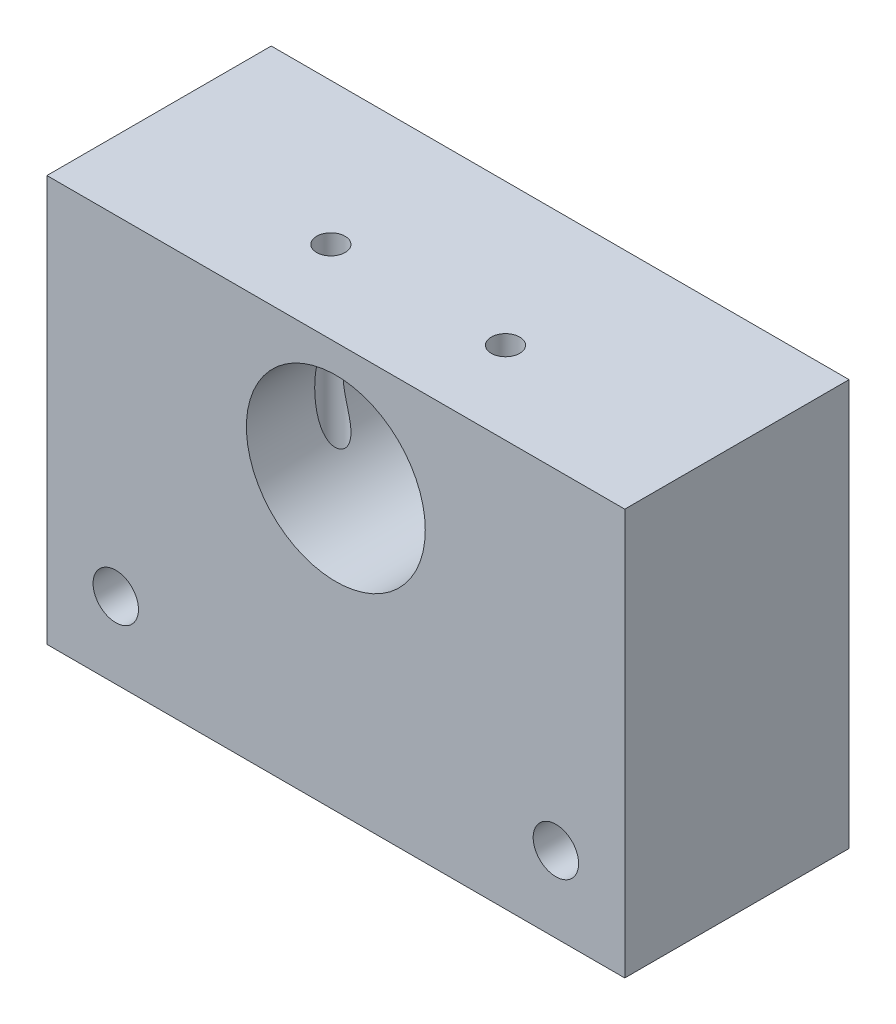
from build123d import *

# Parameters (mm, degrees)
SKETCH_1_W          = 40.7
SKETCH_1_H          = 28.6
EXTRUDE_1_DEPTH     = 15.8
SKETCH_2_R          = 1.6
SKETCH_2_R_2        = 6.3
CUT_EXTRUDE_1_DEPTH = 53.192815598
SKETCH_3_R          = 1
CUT_EXTRUDE_2_DEPTH = 53.192815598


with BuildPart() as part:
    # Эскиз1 → Бобышка-Вытянуть1 (new body)
    with BuildSketch(Plane.XY):
        with Locations((20.35, 14.3)):
            Rectangle(SKETCH_1_W, SKETCH_1_H)
    extrude(amount=EXTRUDE_1_DEPTH)

    # Эскиз2 → Вырез-Вытянуть1 (cut, through all)
    with BuildSketch(Plane.XY.offset(15.8)):
        with Locations((35.85, 5.35)):
            Circle(SKETCH_2_R)
        with Locations((4.85, 5.35)):
            Circle(SKETCH_2_R)
        with Locations((20.35, 20.3)):
            Circle(SKETCH_2_R_2)
    extrude(amount=-CUT_EXTRUDE_1_DEPTH, mode=Mode.SUBTRACT)

    # Эскиз3 → Вырез-Вытянуть2 (cut, through all)
    with BuildSketch(Plane.XZ):
        with Locations(Location((14.2, 10, 0), (0, 0, 270))):
            Circle(SKETCH_3_R)
        with Locations(Location((26.5, 10, 0), (0, 0, 270))):
            Circle(SKETCH_3_R)
    extrude(amount=-CUT_EXTRUDE_2_DEPTH, mode=Mode.SUBTRACT)


solid = part.part
